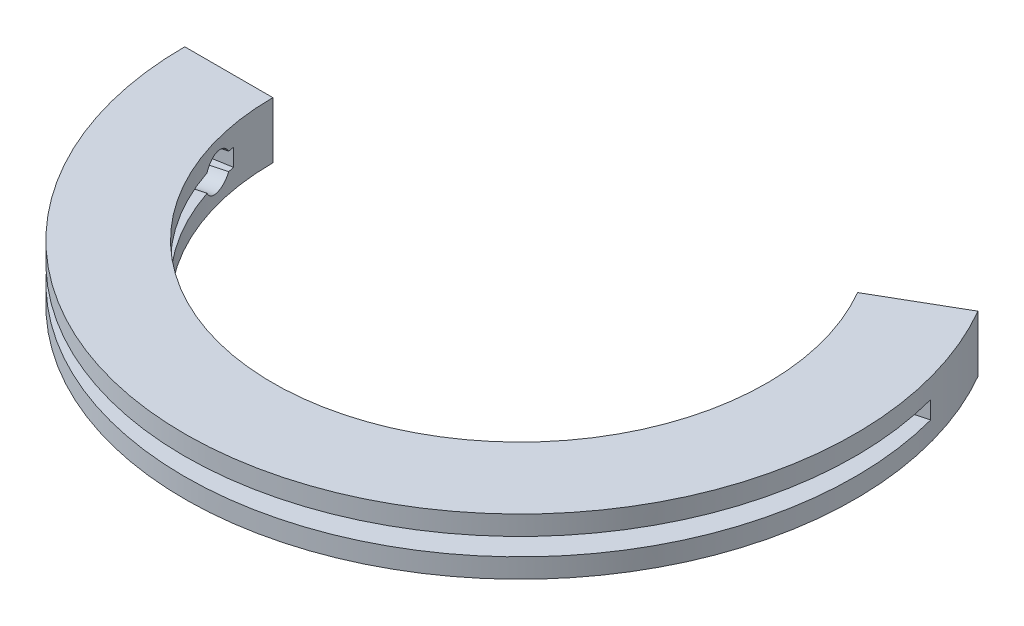
from build123d import *

# Parameters (mm, degrees)
REVOLVE_3_ANGLE               = 210
SKETCH_11_W                   = 1123.766968822
SKETCH_11_H                   = 50
CUT_REVOLVE_6_ANGLE           = 5
CUT_REVOLVE_6_OTHER_WAY_ANGLE = 180


with BuildPart() as part:
    # 草图4 → 旋转3 (revolve)
    with BuildSketch(Plane.XY):
        Polygon((-949.526197638, 0), (-949.526197638, -80), (-700, -80), (-700, 80), (-949.526197638, 80), align=None)
    revolve(axis=Axis((0, 0, 0), (0, 1, 0)), revolution_arc=REVOLVE_3_ANGLE)

    # 草图10 → 切除-旋转5 (revolve, cut)
    with BuildSketch(Plane(origin=(0, 0, 0), x_dir=(0.9659258262890681, 0, -0.2588190451025215), z_dir=(0.2588190451025215, 0, 0.9659258262890681)), mode=Mode.PRIVATE) as cut_revolve_5_sk:
        with BuildLine():
            Line((-750, 50), (750, 50))
            ThreePointArc((750, 50), (785.355339059, 35.355339059), (800, 0))
            Line((800, 0), (-800, 0))
            ThreePointArc((-800, 0), (-785.355339059, 35.355339059), (-750, 50))
        make_face()
    revolve(cut_revolve_5_sk.sketch.rotate(Axis((-1280.947086283, 0, 343.228737317), (0.9659258262890681, 0, -0.25881904510252157)), 90), axis=Axis((-1280.947086283, 0, 343.228737317), (0.9659258262890681, 0, -0.25881904510252157)), mode=Mode.SUBTRACT)

    # 草图11 → 切除-旋转6 (revolve, cut)
    with BuildSketch(Plane(origin=(0, 0, 0), x_dir=(0.9659258262890681, 0, -0.2588190451025215), z_dir=(0.2588190451025215, 0, 0.9659258262890681))):
        with Locations((-561.883484411, 0)):
            Rectangle(SKETCH_11_W, SKETCH_11_H)
    revolve(axis=Axis((0, 25, 0), (0, -1, 0)), revolution_arc=CUT_REVOLVE_6_ANGLE, mode=Mode.SUBTRACT)

    # 草图11 → 切除-旋转6 other way (revolve, cut)
    with BuildSketch(Plane(origin=(0, 0, 0), x_dir=(0.9659258262890681, 0, -0.2588190451025215), z_dir=(0.2588190451025215, 0, 0.9659258262890681))):
        with Locations((-561.883484411, 0)):
            Rectangle(SKETCH_11_W, SKETCH_11_H)
    revolve(axis=Axis((0, 25, 0), (0, 1, 0)), revolution_arc=CUT_REVOLVE_6_OTHER_WAY_ANGLE, mode=Mode.SUBTRACT)


solid = part.part
